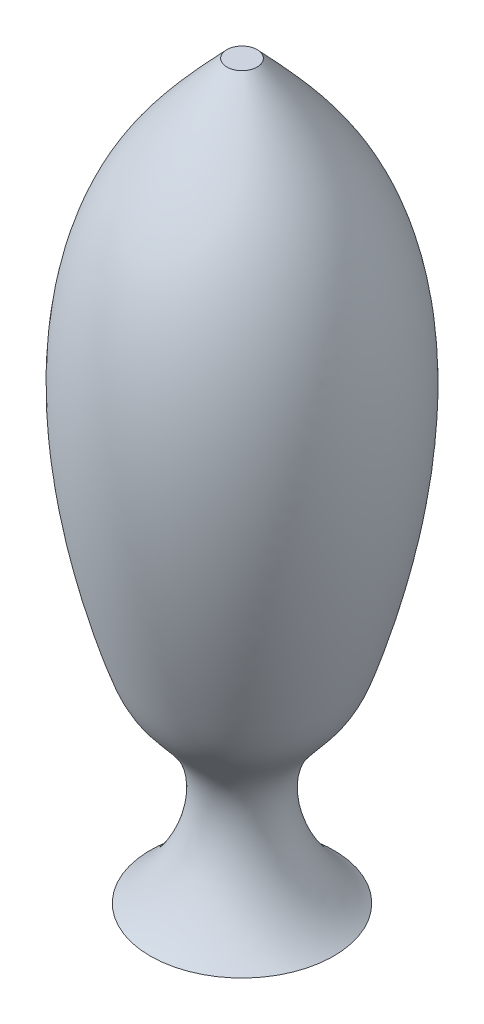
from build123d import *

# Parameters (mm, degrees)
SKETCH_1_R      = 8
EXTRUDE_1_DEPTH = 40


with BuildPart() as part:
    # 草图1 → 凸台-拉伸1 (new body)
    with BuildSketch(Plane(origin=(0, 0, 0), x_dir=(1, 0, 0), z_dir=(0, 1, 0))):
        with Locations(Location((0, 0, 0), (0, 0, 270))):
            Circle(SKETCH_1_R)
    extrude(amount=EXTRUDE_1_DEPTH)

    # 草图2 → 切除-旋转1 (revolve, cut)
    with BuildSketch(Plane.XY):
        with BuildLine():
            Line((-1.496676972, 40.56705353), (-0.826298833, 40))
            add(Edge.make_bspline(
                [(-0.826298833, 40), (-2.396922046, 38.33839445), (-9.238614918, 31.10037915), (-7.637209318, 18.486767699), (-4.541840686, 9.502348074), (-0.854324669, 6.39545771), (-3.492188382, -0.010409287), (-21.645612759, -5.492493844), (-23.246950593, 42.322399591), (-5.277207954, 41.035183508), (-2.437960335, 40.683609369), (-1.496676972, 40.56705353)],
                knots=[0, 0, 0, 0, 0.069367297, 0.302166512, 0.328429497, 0.361707958, 0.440321473, 0.478739039, 0.910974015, 0.970485604, 1, 1, 1, 1], degree=3))
        make_face()
    revolve(axis=Axis((0, 40, 0), (0, -1, 0)), mode=Mode.SUBTRACT)


solid = part.part
